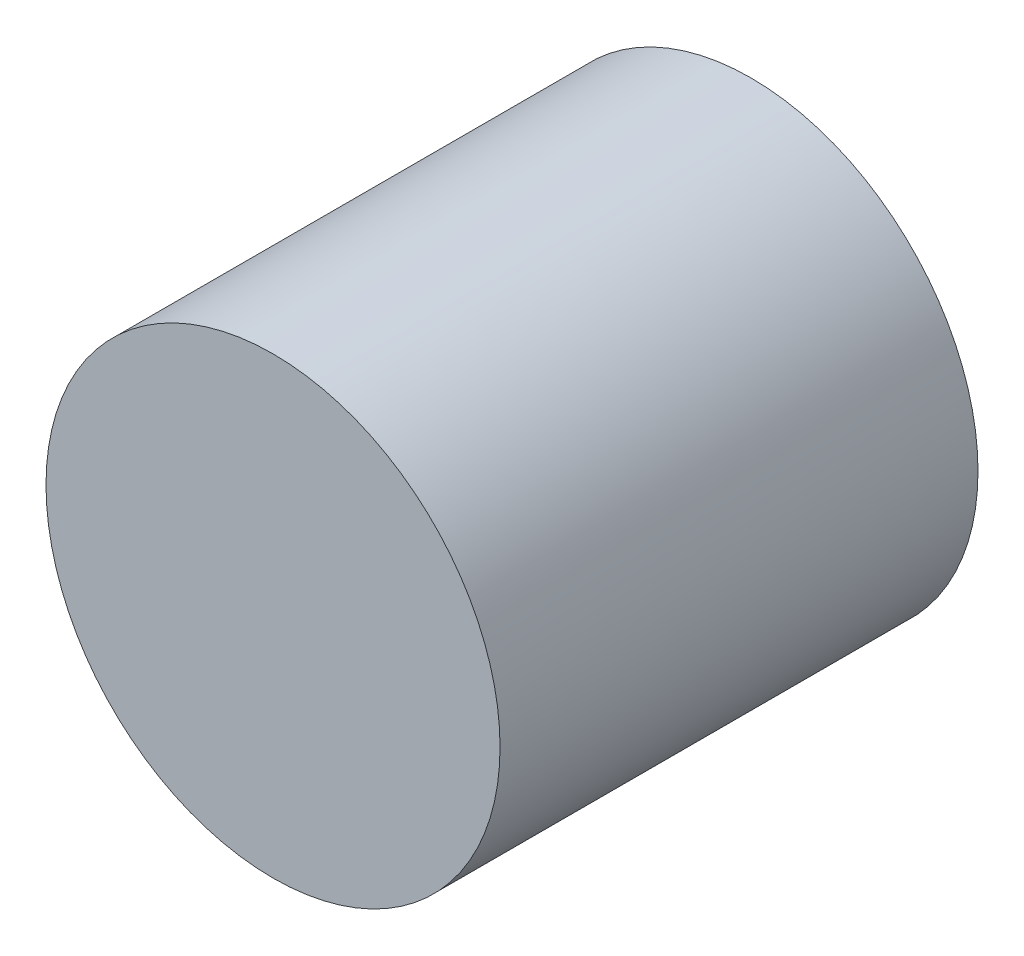
from build123d import *

# Parameters (mm, degrees)
SKETCH1_R           = 4.826
BOSS_EXTRUDE1_DEPTH = 5.08


with BuildPart() as part:
    # Sketch1 → Boss-Extrude1 (new, symmetric)
    with BuildSketch(Plane.XY):
        Circle(SKETCH1_R)
    extrude(amount=BOSS_EXTRUDE1_DEPTH, both=True)


solid = part.part
